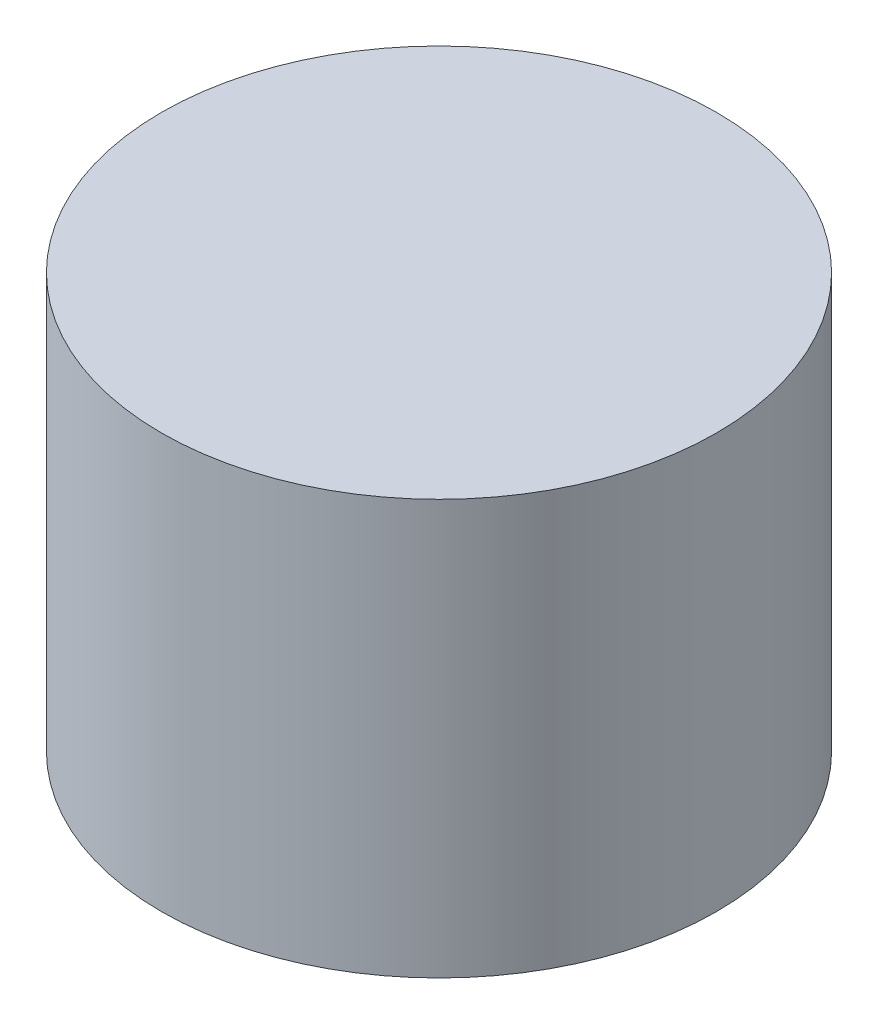
from build123d import *

# Parameters (mm, degrees)
SKETCH1_R           = 7.5
BOSS_EXTRUDE1_DEPTH = 11.2


with BuildPart() as part:
    # Sketch1 → Boss-Extrude1 (new body)
    with BuildSketch(Plane(origin=(0, 0, 0), x_dir=(1, 0, 0), z_dir=(0, 1, 0))):
        with Locations(Location((0, 0, 0), (0, 0, 270))):
            Circle(SKETCH1_R)
    extrude(amount=BOSS_EXTRUDE1_DEPTH)


solid = part.part
